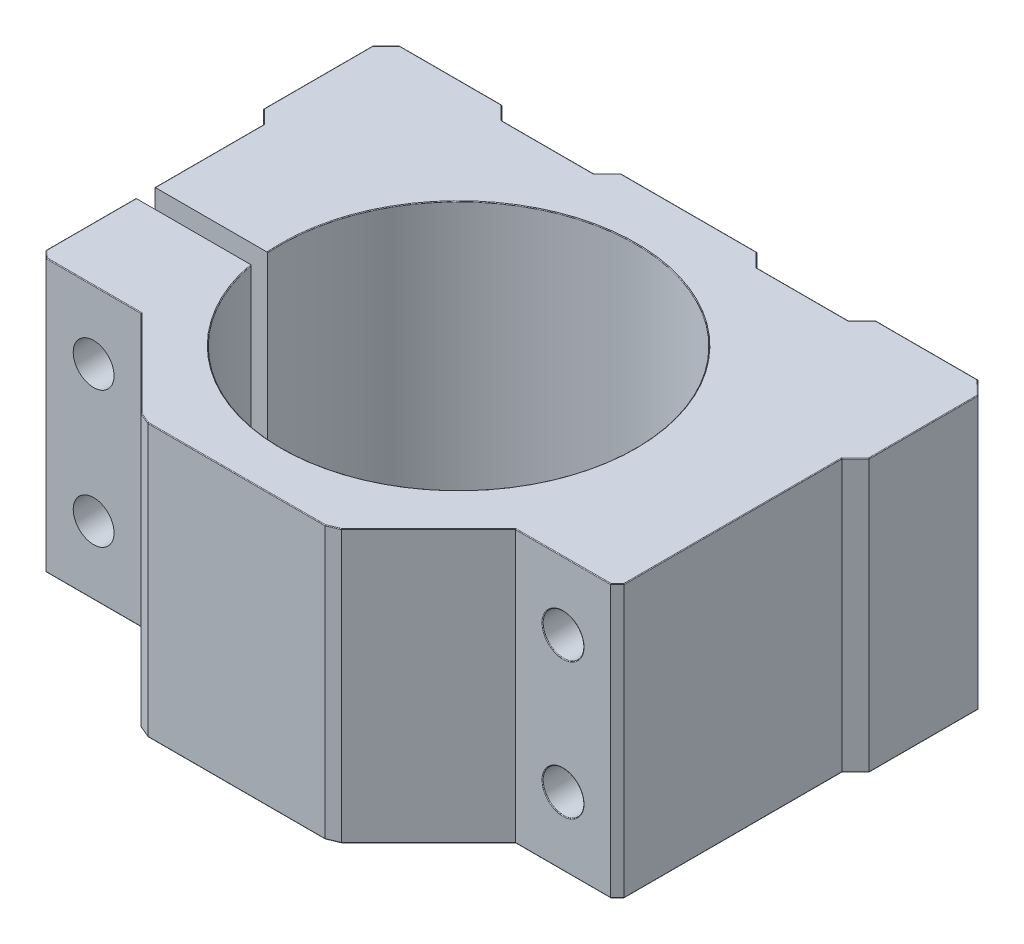
from build123d import *

# Parameters (mm, degrees)
RESSALTO_EXTRUS_O1_DEPTH   = 20
CORTE_EXTRUS_O1_DEPTH      = 61.043734061
CORTE_EXTRUS_O1_DEPTH_BACK = 61.043734061
ESBO_O2_R                  = 3
FILETE1_R                  = 0.1


with BuildPart() as part:
    # Esboço1 → Ressalto-extrusão1 (new, symmetric)
    with BuildSketch(Plane(origin=(0, 0, 0), x_dir=(1, 0, 0), z_dir=(0, 1, 0))):
        with BuildLine():
            Line((41.5, -18), (42.5, -17))
            Line((42.5, -17), (42.5, 15))
            Line((42.5, 15), (44.5, 17))
            Line((44.5, 17), (44.5, 33))
            Line((44.5, 33), (42.5, 35))
            Line((42.5, 35), (27.5, 35))
            Line((27.5, 35), (25.5, 33))
            Line((25.5, 33), (12, 33))
            Line((12, 33), (10, 35))
            Line((10, 35), (-10, 35))
            Line((-10, 35), (-12, 33))
            Line((-12, 33), (-25.5, 33))
            Line((-25.5, 33), (-27.5, 35))
            Line((-27.5, 35), (-42.5, 35))
            Line((-42.5, 35), (-44.5, 33))
            Line((-44.5, 33), (-44.5, 17))
            Line((-44.5, 17), (-42.5, 15))
            Line((-42.5, 15), (-42.5, -1))
            Line((-42.5, -1), (-25.931028754, -1))
            ThreePointArc((-25.931028754, -1), (25.7759765, 4.70524791), (-25.544828287, -3.8))
            Line((-25.544828287, -3.8), (-42.5, -3.8))
            Line((-42.5, -3.8), (-42.5, -17))
            Line((-42.5, -17), (-41.5, -18))
            Line((-41.5, -18), (-27.5, -18))
            Line((-27.5, -18), (-14.707106781, -30.792893219))
            Line((-14.707106781, -30.792893219), (-13, -31.5))
            Line((-13, -31.5), (13, -31.5))
            Line((13, -31.5), (14.707106781, -30.792893219))
            Line((14.707106781, -30.792893219), (27.5, -18))
            Line((27.5, -18), (41.5, -18))
        make_face()
    extrude(amount=RESSALTO_EXTRUS_O1_DEPTH, both=True)

    # Esboço2 → Corte-extrusão1 (cut, two sides: drawn at the far end of the back side and taken through both)
    with BuildSketch(Plane.XY.offset(-CORTE_EXTRUS_O1_DEPTH_BACK)):
        with Locations((34.5, 10)):
            Circle(ESBO_O2_R)
        with Locations(Location((34.5, -10, 0), (0, 0, 180))):
            Circle(ESBO_O2_R)
        with Locations((-34.5, -10)):
            Circle(ESBO_O2_R)
        with Locations((-34.5, 10)):
            Circle(ESBO_O2_R)
    extrude(amount=CORTE_EXTRUS_O1_DEPTH + CORTE_EXTRUS_O1_DEPTH_BACK, mode=Mode.SUBTRACT)

    # Filete1
    filete1_edges = [part.edges().sort_by_distance(p)[0] for p in [
        (42, 20, 17.5),
        (42.5, 20, 1),
        (43.5, 20, -16),
        (44.5, 20, -25),
        (43.5, 20, -34),
        (35, 20, -35),
        (13.853553391, -20, 31.146446609),
        (0, -20, 31.5),
        (-13.853553391, -20, 31.146446609),
        (-21.103553391, -20, 24.396446609),
        (-34.5, -20, 18),
        (-42, -20, 17.5),
        (-42.5, -20, 10.4),
        (26.5, 20, -34),
        (25.7759765, -20, -4.70524791),
        (-42.5, -20, -7),
        (-43.5, -20, -16),
        (-44.5, -20, -25),
        (-43.5, -20, -34),
        (-35, -20, -35),
        (18.75, 20, -33),
        (-26.5, -20, -34),
        (-18.75, -20, -33),
        (-11, -20, -34),
        (0, -20, -35),
        (11, -20, -34),
        (18.75, -20, -33),
        (26.5, -20, -34),
        (11, 20, -34),
        (35, -20, -35),
        (43.5, -20, -34),
        (44.5, -20, -25),
        (43.5, -20, -16),
        (42.5, -20, 1),
        (42, -20, 17.5),
        (34.5, -20, 18),
        (21.103553391, -20, 24.396446609),
        (0, 20, -35),
        (21.103553391, 20, 24.396446609),
        (-11, 20, -34),
        (-18.75, 20, -33),
        (-26.5, 20, -34),
        (-35, 20, -35),
        (-43.5, 20, -34),
        (-44.5, 20, -25),
        (-43.5, 20, -16),
        (-42.5, 20, -7),
        (25.7759765, 20, -4.70524791),
        (34.5, 20, 18),
        (-42.5, 20, 10.4),
        (-42, 20, 17.5),
        (-34.5, 20, 18),
        (-21.103553391, 20, 24.396446609),
        (37.5, -10, -35),
        (-13.853553391, 20, 31.146446609),
        (37.5, -10, 18),
        (31.5, 10, -35),
        (31.5, 10, 18),
        (0, 20, 31.5),
        (-37.5, 10, -35),
        (-37.5, 10, 1),
        (13.853553391, 20, 31.146446609),
        (-37.5, -10, -35),
        (-37.5, -10, 1),
    ]]
    fillet(filete1_edges, radius=FILETE1_R)


solid = part.part
